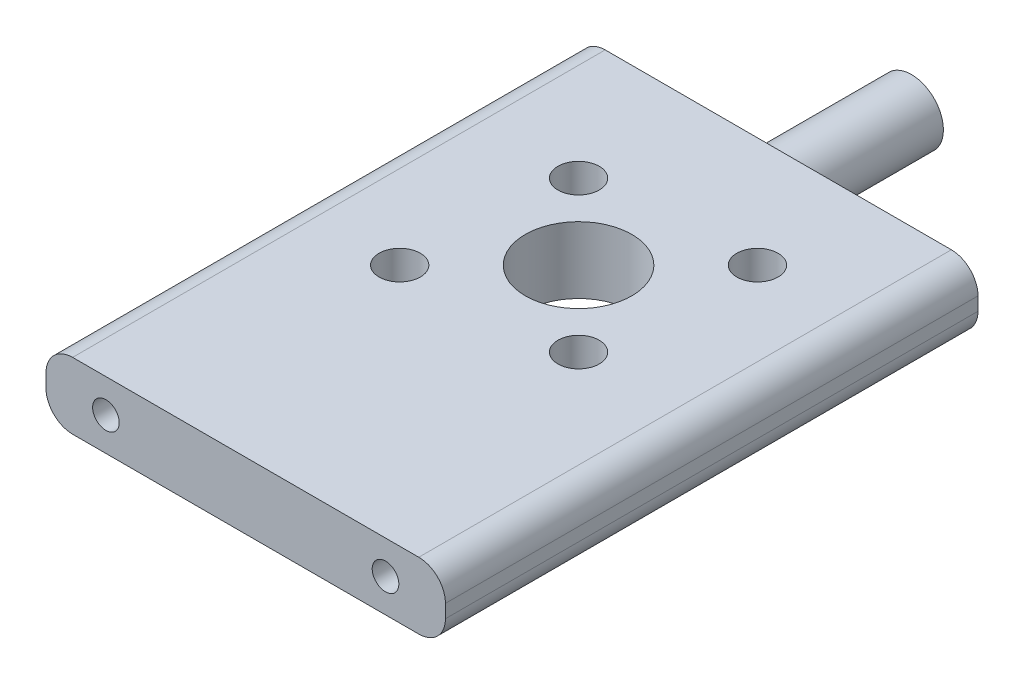
from build123d import *

# Parameters (mm, degrees)
SKETCH1_W           = 30
SKETCH1_H           = 40
BOSS_EXTRUDE1_DEPTH = 5
SKETCH2_R           = 4
CUT_EXTRUDE1_DEPTH  = 5
SKETCH3_R           = 1.55
CUT_EXTRUDE2_DEPTH  = 5
SKETCH4_R           = 1
CUT_EXTRUDE3_DEPTH  = 5
SKETCH5_R           = 2.4
BOSS_EXTRUDE2_DEPTH = 10
FILLET1_R           = 2


with BuildPart() as part:
    # Sketch1 → Boss-Extrude1 (new body)
    with BuildSketch(Plane(origin=(0, 0, 0), x_dir=(1, 0, 0), z_dir=(0, 1, 0))):
        with Locations((7.687417977, 6.194491888)):
            Rectangle(SKETCH1_W, SKETCH1_H)
    extrude(amount=BOSS_EXTRUDE1_DEPTH)

    # Sketch2 → Cut-Extrude1 (cut)
    with BuildSketch(Plane(origin=(0, 5, 0), x_dir=(-1, 0, 0), z_dir=(0, 1, 0))):
        with Locations(Location((-7.687417977, -11.194491888, 0), (0, 0, 90))):
            Circle(SKETCH2_R)
    extrude(amount=-CUT_EXTRUDE1_DEPTH, mode=Mode.SUBTRACT)

    # Sketch3 → Cut-Extrude2 (cut)
    with BuildSketch(Plane(origin=(0, 5, 0), x_dir=(1, 0, 0), z_dir=(0, 1, 0))):
        with Locations(Location((2.030563727, 16.851346138, 0), (0, 0, 270))):
            Circle(SKETCH3_R)
        with Locations(Location((14.404932398, 17.912006309, 0), (0, 0, 270))):
            Circle(SKETCH3_R)
        with Locations(Location((13.344272226, 5.537637639, 0), (0, 0, 270))):
            Circle(SKETCH3_R)
        with Locations(Location((0.969903556, 4.476977467, 0), (0, 0, 270))):
            Circle(SKETCH3_R)
    extrude(amount=-CUT_EXTRUDE2_DEPTH, mode=Mode.SUBTRACT)

    # Sketch4 → Cut-Extrude3 (cut)
    with BuildSketch(Plane.XY.offset(13.805508112)):
        with Locations((-2.812582023, 2.5)):
            Circle(SKETCH4_R)
        with Locations((18.187417977, 2.5)):
            Circle(SKETCH4_R)
    extrude(amount=-CUT_EXTRUDE3_DEPTH, mode=Mode.SUBTRACT)

    # Sketch5 → Boss-Extrude2 (add)
    with BuildSketch(Plane(origin=(0, 0, -26.194491888), x_dir=(-1, 0, 0), z_dir=(0, 0, -1))):
        with Locations(Location((-7.687417977, 2.5, 0), (0, 0, 180))):
            Circle(SKETCH5_R)
    extrude(amount=BOSS_EXTRUDE2_DEPTH)

    # Fillet1
    fillet1_edges = [part.edges().sort_by_distance(p)[0] for p in [
        (-7.312582023, 5, -6.194491888),
        (22.687417977, 5, -6.194491888),
        (-7.312582023, 0, -6.194491888),
        (22.687417977, 0, -6.194491888),
    ]]
    fillet(fillet1_edges, radius=FILLET1_R)


solid = part.part
